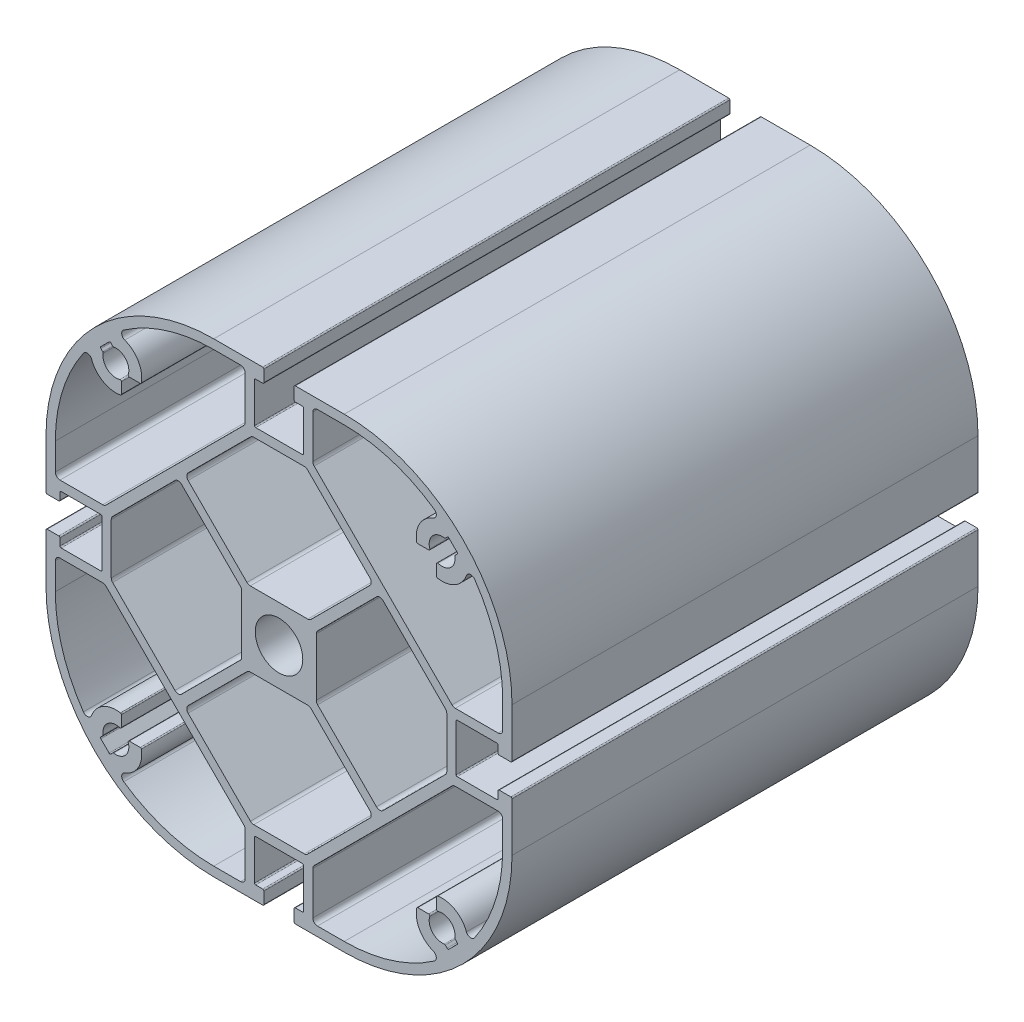
from build123d import *

# Parameters (mm, degrees)
IZIM1_R                     = 5.1
Y_KSEKLIK_EKSTR_ZYON1_DEPTH = 100


with BuildPart() as part:
    # Çizim1 → Yükseklik-Ekstrüzyon1 (new body)
    with BuildSketch(Plane.XY):
        with BuildLine():
            ThreePointArc((3.5, 50), (3.323223305, 49.926776695), (3.25, 49.75))
            Line((3.25, 49.75), (3.25, 47.25))
            ThreePointArc((3.25, 47.25), (3.323223305, 47.073223305), (3.5, 47))
            Line((3.5, 47), (5, 47))
            ThreePointArc((5, 47), (5.176776695, 46.926776695), (5.25, 46.75))
            Line((5.25, 46.75), (5.25, 38.25))
            ThreePointArc((5.25, 38.25), (5.176776695, 38.073223305), (5, 38))
            Line((5, 38), (-5, 38))
            ThreePointArc((-5, 38), (-5.176776695, 38.073223305), (-5.25, 38.25))
            Line((-5.25, 38.25), (-5.25, 46.75))
            ThreePointArc((-5.25, 46.75), (-5.176776695, 46.926776695), (-5, 47))
            Line((-5, 47), (-3.5, 47))
            ThreePointArc((-3.5, 47), (-3.323223305, 47.073223305), (-3.25, 47.25))
            Line((-3.25, 47.25), (-3.25, 49.75))
            ThreePointArc((-3.25, 49.75), (-3.323223305, 49.926776695), (-3.5, 50))
            Line((-3.5, 50), (-14, 50))
            ThreePointArc((-14, 50), (-39.455844123, 39.455844123), (-50, 14))
            Line((-50, 14), (-50, 3.5))
            ThreePointArc((-50, 3.5), (-49.926776695, 3.323223305), (-49.75, 3.25))
            Line((-49.75, 3.25), (-47.25, 3.25))
            ThreePointArc((-47.25, 3.25), (-47.073223305, 3.323223305), (-47, 3.5))
            Line((-47, 3.5), (-47, 5))
            ThreePointArc((-47, 5), (-46.926776695, 5.176776695), (-46.75, 5.25))
            Line((-46.75, 5.25), (-38.25, 5.25))
            ThreePointArc((-38.25, 5.25), (-38.073223305, 5.176776695), (-38, 5))
            Line((-38, 5), (-38, -5))
            ThreePointArc((-38, -5), (-38.073223305, -5.176776695), (-38.25, -5.25))
            Line((-38.25, -5.25), (-46.75, -5.25))
            ThreePointArc((-46.75, -5.25), (-46.926776695, -5.176776695), (-47, -5))
            Line((-47, -5), (-47, -3.5))
            ThreePointArc((-47, -3.5), (-47.073223305, -3.323223305), (-47.25, -3.25))
            Line((-47.25, -3.25), (-49.75, -3.25))
            ThreePointArc((-49.75, -3.25), (-49.926776695, -3.323223305), (-50, -3.5))
            Line((-50, -3.5), (-50, -14))
            ThreePointArc((-50, -14), (-39.455844123, -39.455844123), (-14, -50))
            Line((-14, -50), (-3.5, -50))
            ThreePointArc((-3.5, -50), (-3.323223305, -49.926776695), (-3.25, -49.75))
            Line((-3.25, -49.75), (-3.25, -47.25))
            ThreePointArc((-3.25, -47.25), (-3.323223305, -47.073223305), (-3.5, -47))
            Line((-3.5, -47), (-5, -47))
            ThreePointArc((-5, -47), (-5.176776695, -46.926776695), (-5.25, -46.75))
            Line((-5.25, -46.75), (-5.25, -38.25))
            ThreePointArc((-5.25, -38.25), (-5.176776695, -38.073223305), (-5, -38))
            Line((-5, -38), (5, -38))
            ThreePointArc((5, -38), (5.176776695, -38.073223305), (5.25, -38.25))
            Line((5.25, -38.25), (5.25, -46.75))
            ThreePointArc((5.25, -46.75), (5.176776695, -46.926776695), (5, -47))
            Line((5, -47), (3.5, -47))
            ThreePointArc((3.5, -47), (3.323223305, -47.073223305), (3.25, -47.25))
            Line((3.25, -47.25), (3.25, -49.75))
            ThreePointArc((3.25, -49.75), (3.323223305, -49.926776695), (3.5, -50))
            Line((3.5, -50), (14, -50))
            ThreePointArc((14, -50), (39.455844123, -39.455844123), (50, -14))
            Line((50, -14), (50, -3.5))
            ThreePointArc((50, -3.5), (49.926776695, -3.323223305), (49.75, -3.25))
            Line((49.75, -3.25), (47.25, -3.25))
            ThreePointArc((47.25, -3.25), (47.073223305, -3.323223305), (47, -3.5))
            Line((47, -3.5), (47, -5))
            ThreePointArc((47, -5), (46.926776695, -5.176776695), (46.75, -5.25))
            Line((46.75, -5.25), (38.25, -5.25))
            ThreePointArc((38.25, -5.25), (38.073223305, -5.176776695), (38, -5))
            Line((38, -5), (38, 5))
            ThreePointArc((38, 5), (38.073223305, 5.176776695), (38.25, 5.25))
            Line((38.25, 5.25), (46.75, 5.25))
            ThreePointArc((46.75, 5.25), (46.926776695, 5.176776695), (47, 5))
            Line((47, 5), (47, 3.5))
            ThreePointArc((47, 3.5), (47.073223305, 3.323223305), (47.25, 3.25))
            Line((47.25, 3.25), (49.75, 3.25))
            ThreePointArc((49.75, 3.25), (49.926776695, 3.323223305), (50, 3.5))
            Line((50, 3.5), (50, 14))
            ThreePointArc((50, 14), (47.25966317, 27.776603565), (39.455844123, 39.455844123))
            ThreePointArc((39.455844123, 39.455844123), (27.776603565, 47.25966317), (14, 50))
            Line((14, 50), (3.5, 50))
        make_face()
        with BuildLine():
            Line((5.421572875, -36), (-5.421572875, -36))
            ThreePointArc((-5.421572875, -36), (-5.804256308, -35.923879533), (-6.128679656, -35.707106781))
            Line((-6.128679656, -35.707106781), (-19.503679656, -22.332106781))
            ThreePointArc((-19.503679656, -22.332106781), (-19.796572875, -21.625), (-19.503679656, -20.917893219))
            Line((-19.503679656, -20.917893219), (-6.878679656, -8.292893219))
            ThreePointArc((-6.878679656, -8.292893219), (-6.554256308, -8.076120467), (-6.171572875, -8))
            Line((-6.171572875, -8), (6.171572875, -8))
            ThreePointArc((6.171572875, -8), (6.554256308, -8.076120467), (6.878679656, -8.292893219))
            Line((6.878679656, -8.292893219), (19.503679656, -20.917893219))
            ThreePointArc((19.503679656, -20.917893219), (19.796572875, -21.625), (19.503679656, -22.332106781))
            Line((19.503679656, -22.332106781), (6.128679656, -35.707106781))
            ThreePointArc((6.128679656, -35.707106781), (5.804256308, -35.923879533), (5.421572875, -36))
        make_face(mode=Mode.SUBTRACT)
        Circle(IZIM1_R, mode=Mode.SUBTRACT)
        with BuildLine():
            Line((-8, 6.171572875), (-8, -6.171572875))
            ThreePointArc((-8, -6.171572875), (-8.076120467, -6.554256308), (-8.292893219, -6.878679656))
            Line((-8.292893219, -6.878679656), (-20.917893219, -19.503679656))
            ThreePointArc((-20.917893219, -19.503679656), (-21.625, -19.796572875), (-22.332106781, -19.503679656))
            Line((-22.332106781, -19.503679656), (-35.707106781, -6.128679656))
            ThreePointArc((-35.707106781, -6.128679656), (-35.923879533, -5.804256308), (-36, -5.421572875))
            Line((-36, -5.421572875), (-36, 5.421572875))
            ThreePointArc((-36, 5.421572875), (-35.923879533, 5.804256308), (-35.707106781, 6.128679656))
            Line((-35.707106781, 6.128679656), (-22.332106781, 19.503679656))
            ThreePointArc((-22.332106781, 19.503679656), (-21.625, 19.796572875), (-20.917893219, 19.503679656))
            Line((-20.917893219, 19.503679656), (-8.292893219, 6.878679656))
            ThreePointArc((-8.292893219, 6.878679656), (-8.076120467, 6.554256308), (-8, 6.171572875))
        make_face(mode=Mode.SUBTRACT)
        with BuildLine():
            Line((36.097086912, -38.218407256), (35.684064018, -37.805384362))
            ThreePointArc((35.684064018, -37.805384362), (35.583183306, -37.743959882), (35.465362751, -37.735701466))
            ThreePointArc((35.465362751, -37.735701466), (32.903982792, -36.818608497), (32.35726356, -34.15349595))
            ThreePointArc((32.35726356, -34.15349595), (32.321126474, -33.929866428), (32.119179196, -33.827234324))
            Line((32.119179196, -33.827234324), (29.780948026, -33.827234324))
            ThreePointArc((29.780948026, -33.827234324), (29.620295716, -33.885685804), (29.534766329, -34.033707641))
            ThreePointArc((29.534766329, -34.033707641), (30.191646465, -37.771684738), (33.097024373, -40.213557688))
            ThreePointArc((33.097024373, -40.213557688), (33.746062554, -41.026046494), (33.322453333, -41.975753738))
            ThreePointArc((33.322453333, -41.975753738), (24.119890635, -46.459017446), (14, -48))
            Line((14, -48), (8.25, -48))
            ThreePointArc((8.25, -48), (7.542893219, -47.707106781), (7.25, -47))
            Line((7.25, -47), (7.25, -37.828427125))
            ThreePointArc((7.25, -37.828427125), (7.326120467, -37.445743692), (7.542893219, -37.121320344))
            Line((7.542893219, -37.121320344), (37.121320344, -7.542893219))
            ThreePointArc((37.121320344, -7.542893219), (37.445743692, -7.326120467), (37.828427125, -7.25))
            Line((37.828427125, -7.25), (47, -7.25))
            ThreePointArc((47, -7.25), (47.707106781, -7.542893219), (48, -8.25))
            Line((48, -8.25), (48, -14))
            ThreePointArc((48, -14), (46.459017446, -24.119890635), (41.975753738, -33.322453333))
            ThreePointArc((41.975753738, -33.322453333), (41.026046494, -33.746062554), (40.213557688, -33.097024373))
            ThreePointArc((40.213557688, -33.097024373), (37.771684738, -30.191646465), (34.033707641, -29.534766329))
            ThreePointArc((34.033707641, -29.534766329), (33.885685804, -29.620295716), (33.827234324, -29.780948026))
            Line((33.827234324, -29.780948026), (33.827234324, -32.119179196))
            ThreePointArc((33.827234324, -32.119179196), (33.929866428, -32.321126474), (34.15349595, -32.35726356))
            ThreePointArc((34.15349595, -32.35726356), (36.818608497, -32.903982792), (37.735701466, -35.465362751))
            ThreePointArc((37.735701466, -35.465362751), (37.743959882, -35.583183306), (37.805384362, -35.684064018))
            Line((37.805384362, -35.684064018), (38.218407256, -36.097086912))
            ThreePointArc((38.218407256, -36.097086912), (38.29163056, -36.273863607), (38.218407256, -36.450640303))
            Line((38.218407256, -36.450640303), (36.450640303, -38.218407256))
            ThreePointArc((36.450640303, -38.218407256), (36.273863607, -38.29163056), (36.097086912, -38.218407256))
        make_face(mode=Mode.SUBTRACT)
        with BuildLine():
            Line((36, 5.421572875), (36, -5.421572875))
            ThreePointArc((36, -5.421572875), (35.923879533, -5.804256308), (35.707106781, -6.128679656))
            Line((35.707106781, -6.128679656), (22.332106781, -19.503679656))
            ThreePointArc((22.332106781, -19.503679656), (21.625, -19.796572875), (20.917893219, -19.503679656))
            Line((20.917893219, -19.503679656), (8.292893219, -6.878679656))
            ThreePointArc((8.292893219, -6.878679656), (8.076120467, -6.554256308), (8, -6.171572875))
            Line((8, -6.171572875), (8, 6.171572875))
            ThreePointArc((8, 6.171572875), (8.076120467, 6.554256308), (8.292893219, 6.878679656))
            Line((8.292893219, 6.878679656), (20.917893219, 19.503679656))
            ThreePointArc((20.917893219, 19.503679656), (21.625, 19.796572875), (22.332106781, 19.503679656))
            Line((22.332106781, 19.503679656), (35.707106781, 6.128679656))
            ThreePointArc((35.707106781, 6.128679656), (35.923879533, 5.804256308), (36, 5.421572875))
        make_face(mode=Mode.SUBTRACT)
        with BuildLine():
            Line((-36.097086912, 38.218407256), (-35.684064018, 37.805384362))
            ThreePointArc((-35.684064018, 37.805384362), (-35.583183306, 37.743959882), (-35.465362751, 37.735701466))
            ThreePointArc((-35.465362751, 37.735701466), (-32.903982792, 36.818608497), (-32.35726356, 34.15349595))
            ThreePointArc((-32.35726356, 34.15349595), (-32.321126474, 33.929866428), (-32.119179196, 33.827234324))
            Line((-32.119179196, 33.827234324), (-29.780948026, 33.827234324))
            ThreePointArc((-29.780948026, 33.827234324), (-29.620295716, 33.885685804), (-29.534766329, 34.033707641))
            ThreePointArc((-29.534766329, 34.033707641), (-30.191646465, 37.771684738), (-33.097024373, 40.213557688))
            ThreePointArc((-33.097024373, 40.213557688), (-33.746062554, 41.026046494), (-33.322453333, 41.975753738))
            ThreePointArc((-33.322453333, 41.975753738), (-24.119890635, 46.459017446), (-14, 48))
            Line((-14, 48), (-8.25, 48))
            ThreePointArc((-8.25, 48), (-7.542893219, 47.707106781), (-7.25, 47))
            Line((-7.25, 47), (-7.25, 37.828427125))
            ThreePointArc((-7.25, 37.828427125), (-7.326120467, 37.445743692), (-7.542893219, 37.121320344))
            Line((-7.542893219, 37.121320344), (-37.121320344, 7.542893219))
            ThreePointArc((-37.121320344, 7.542893219), (-37.445743692, 7.326120467), (-37.828427125, 7.25))
            Line((-37.828427125, 7.25), (-47, 7.25))
            ThreePointArc((-47, 7.25), (-47.707106781, 7.542893219), (-48, 8.25))
            Line((-48, 8.25), (-48, 14))
            ThreePointArc((-48, 14), (-46.459017446, 24.119890635), (-41.975753738, 33.322453333))
            ThreePointArc((-41.975753738, 33.322453333), (-41.026046494, 33.746062554), (-40.213557688, 33.097024373))
            ThreePointArc((-40.213557688, 33.097024373), (-37.771684738, 30.191646465), (-34.033707641, 29.534766329))
            ThreePointArc((-34.033707641, 29.534766329), (-33.885685804, 29.620295716), (-33.827234324, 29.780948026))
            Line((-33.827234324, 29.780948026), (-33.827234324, 32.119179196))
            ThreePointArc((-33.827234324, 32.119179196), (-33.929866428, 32.321126474), (-34.15349595, 32.35726356))
            ThreePointArc((-34.15349595, 32.35726356), (-36.818608497, 32.903982792), (-37.735701466, 35.465362751))
            ThreePointArc((-37.735701466, 35.465362751), (-37.743959882, 35.583183306), (-37.805384362, 35.684064018))
            Line((-37.805384362, 35.684064018), (-38.218407256, 36.097086912))
            ThreePointArc((-38.218407256, 36.097086912), (-38.29163056, 36.273863607), (-38.218407256, 36.450640303))
            Line((-38.218407256, 36.450640303), (-36.450640303, 38.218407256))
            ThreePointArc((-36.450640303, 38.218407256), (-36.273863607, 38.29163056), (-36.097086912, 38.218407256))
        make_face(mode=Mode.SUBTRACT)
        with BuildLine():
            Line((6.171572875, 8), (-6.171572875, 8))
            ThreePointArc((-6.171572875, 8), (-6.554256308, 8.076120467), (-6.878679656, 8.292893219))
            Line((-6.878679656, 8.292893219), (-19.503679656, 20.917893219))
            ThreePointArc((-19.503679656, 20.917893219), (-19.796572875, 21.625), (-19.503679656, 22.332106781))
            Line((-19.503679656, 22.332106781), (-6.128679656, 35.707106781))
            ThreePointArc((-6.128679656, 35.707106781), (-5.804256308, 35.923879533), (-5.421572875, 36))
            Line((-5.421572875, 36), (5.421572875, 36))
            ThreePointArc((5.421572875, 36), (5.804256308, 35.923879533), (6.128679656, 35.707106781))
            Line((6.128679656, 35.707106781), (19.503679656, 22.332106781))
            ThreePointArc((19.503679656, 22.332106781), (19.796572875, 21.625), (19.503679656, 20.917893219))
            Line((19.503679656, 20.917893219), (6.878679656, 8.292893219))
            ThreePointArc((6.878679656, 8.292893219), (6.554256308, 8.076120467), (6.171572875, 8))
        make_face(mode=Mode.SUBTRACT)
        with BuildLine():
            Line((36.450640303, 38.218407256), (37.334523779, 37.334523779))
            Line((37.334523779, 37.334523779), (38.218407256, 36.450640303))
            ThreePointArc((38.218407256, 36.450640303), (38.29163056, 36.273863607), (38.218407256, 36.097086912))
            Line((38.218407256, 36.097086912), (37.805384362, 35.684064018))
            ThreePointArc((37.805384362, 35.684064018), (37.743959882, 35.583183306), (37.735701466, 35.465362751))
            ThreePointArc((37.735701466, 35.465362751), (36.818608497, 32.903982792), (34.15349595, 32.35726356))
            ThreePointArc((34.15349595, 32.35726356), (33.929866428, 32.321126474), (33.827234324, 32.119179196))
            Line((33.827234324, 32.119179196), (33.827234324, 29.780948026))
            ThreePointArc((33.827234324, 29.780948026), (33.885685804, 29.620295716), (34.033707641, 29.534766329))
            ThreePointArc((34.033707641, 29.534766329), (37.771684738, 30.191646465), (40.213557688, 33.097024373))
            ThreePointArc((40.213557688, 33.097024373), (41.026046494, 33.746062554), (41.975753738, 33.322453333))
            ThreePointArc((41.975753738, 33.322453333), (46.459017446, 24.119890635), (48, 14))
            Line((48, 14), (48, 8.25))
            ThreePointArc((48, 8.25), (47.707106781, 7.542893219), (47, 7.25))
            Line((47, 7.25), (37.828427125, 7.25))
            ThreePointArc((37.828427125, 7.25), (37.445743692, 7.326120467), (37.121320344, 7.542893219))
            Line((37.121320344, 7.542893219), (7.542893219, 37.121320344))
            ThreePointArc((7.542893219, 37.121320344), (7.326120467, 37.445743692), (7.25, 37.828427125))
            Line((7.25, 37.828427125), (7.25, 47))
            ThreePointArc((7.25, 47), (7.542893219, 47.707106781), (8.25, 48))
            Line((8.25, 48), (14, 48))
            ThreePointArc((14, 48), (24.119890635, 46.459017446), (33.322453333, 41.975753738))
            ThreePointArc((33.322453333, 41.975753738), (33.746062554, 41.026046494), (33.097024373, 40.213557688))
            ThreePointArc((33.097024373, 40.213557688), (30.191646465, 37.771684738), (29.534766329, 34.033707641))
            ThreePointArc((29.534766329, 34.033707641), (29.620295716, 33.885685804), (29.780948026, 33.827234324))
            Line((29.780948026, 33.827234324), (32.119179196, 33.827234324))
            ThreePointArc((32.119179196, 33.827234324), (32.321126474, 33.929866428), (32.35726356, 34.15349595))
            ThreePointArc((32.35726356, 34.15349595), (32.903982792, 36.818608497), (35.465362751, 37.735701466))
            ThreePointArc((35.465362751, 37.735701466), (35.583183306, 37.743959882), (35.684064018, 37.805384362))
            Line((35.684064018, 37.805384362), (36.097086912, 38.218407256))
            ThreePointArc((36.097086912, 38.218407256), (36.273863607, 38.29163056), (36.450640303, 38.218407256))
        make_face(mode=Mode.SUBTRACT)
        with BuildLine():
            Line((-38.218407256, -36.097086912), (-37.805384362, -35.684064018))
            ThreePointArc((-37.805384362, -35.684064018), (-37.743959882, -35.583183306), (-37.735701466, -35.465362751))
            ThreePointArc((-37.735701466, -35.465362751), (-36.818608497, -32.903982792), (-34.15349595, -32.35726356))
            ThreePointArc((-34.15349595, -32.35726356), (-33.929866428, -32.321126474), (-33.827234324, -32.119179196))
            Line((-33.827234324, -32.119179196), (-33.827234324, -29.780948026))
            ThreePointArc((-33.827234324, -29.780948026), (-33.885685804, -29.620295716), (-34.033707641, -29.534766329))
            ThreePointArc((-34.033707641, -29.534766329), (-37.771684738, -30.191646465), (-40.213557688, -33.097024373))
            ThreePointArc((-40.213557688, -33.097024373), (-41.026046494, -33.746062554), (-41.975753738, -33.322453333))
            ThreePointArc((-41.975753738, -33.322453333), (-46.459017446, -24.119890635), (-48, -14))
            Line((-48, -14), (-48, -8.25))
            ThreePointArc((-48, -8.25), (-47.707106781, -7.542893219), (-47, -7.25))
            Line((-47, -7.25), (-37.828427125, -7.25))
            ThreePointArc((-37.828427125, -7.25), (-37.445743692, -7.326120467), (-37.121320344, -7.542893219))
            Line((-37.121320344, -7.542893219), (-7.542893219, -37.121320344))
            ThreePointArc((-7.542893219, -37.121320344), (-7.326120467, -37.445743692), (-7.25, -37.828427125))
            Line((-7.25, -37.828427125), (-7.25, -47))
            ThreePointArc((-7.25, -47), (-7.542893219, -47.707106781), (-8.25, -48))
            Line((-8.25, -48), (-14, -48))
            ThreePointArc((-14, -48), (-24.119890635, -46.459017446), (-33.322453333, -41.975753738))
            ThreePointArc((-33.322453333, -41.975753738), (-33.746062554, -41.026046494), (-33.097024373, -40.213557688))
            ThreePointArc((-33.097024373, -40.213557688), (-30.191646465, -37.771684738), (-29.534766329, -34.033707641))
            ThreePointArc((-29.534766329, -34.033707641), (-29.620295716, -33.885685804), (-29.780948026, -33.827234324))
            Line((-29.780948026, -33.827234324), (-32.119179196, -33.827234324))
            ThreePointArc((-32.119179196, -33.827234324), (-32.321126474, -33.929866428), (-32.35726356, -34.15349595))
            ThreePointArc((-32.35726356, -34.15349595), (-32.903982792, -36.818608497), (-35.465362751, -37.735701466))
            ThreePointArc((-35.465362751, -37.735701466), (-35.583183306, -37.743959882), (-35.684064018, -37.805384362))
            Line((-35.684064018, -37.805384362), (-36.097086912, -38.218407256))
            ThreePointArc((-36.097086912, -38.218407256), (-36.273863607, -38.29163056), (-36.450640303, -38.218407256))
            Line((-36.450640303, -38.218407256), (-38.218407256, -36.450640303))
            ThreePointArc((-38.218407256, -36.450640303), (-38.29163056, -36.273863607), (-38.218407256, -36.097086912))
        make_face(mode=Mode.SUBTRACT)
    extrude(amount=-Y_KSEKLIK_EKSTR_ZYON1_DEPTH)


solid = part.part
